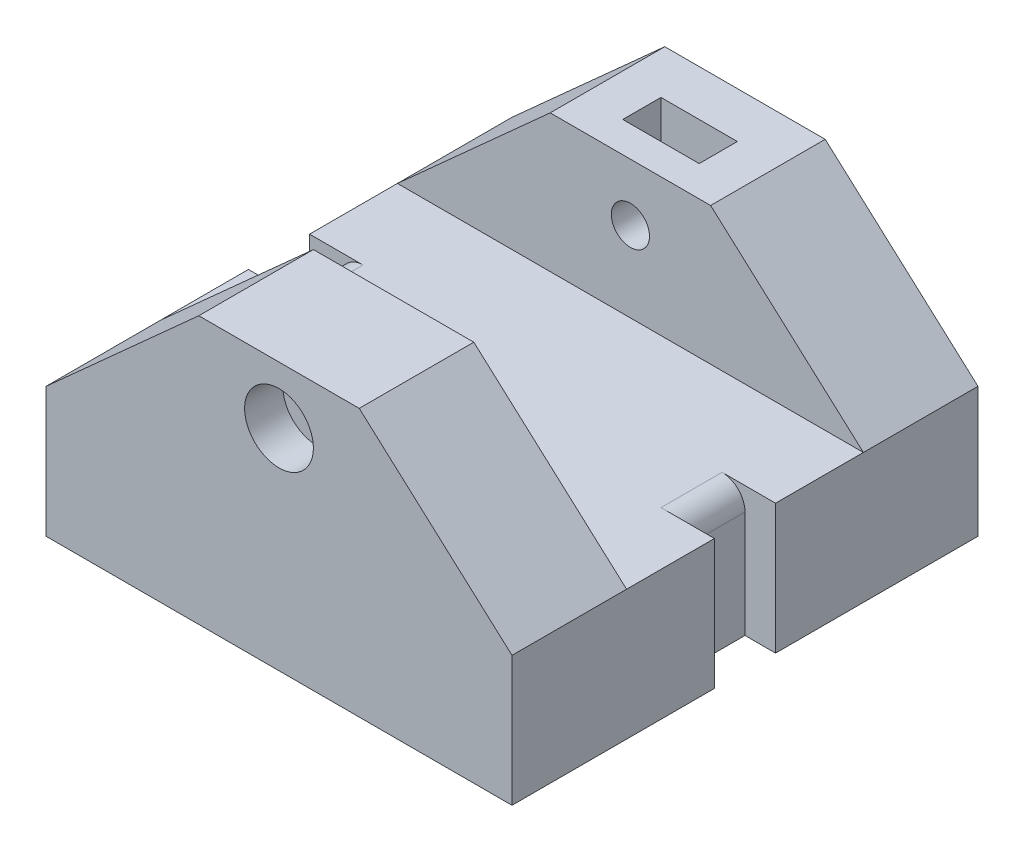
from build123d import *

# Parameters (mm, degrees)
SKETCH1_W           = 61
SKETCH1_H           = 61
SKETCH1_W_2         = 41
SKETCH1_H_2         = 41
BOSS_EXTRUDE1_DEPTH = 15
SKETCH2_W           = 61
SKETCH2_H           = 61
BOSS_EXTRUDE2_DEPTH = 20
SKETCH3_R           = 2.5
CUT_EXTRUDE1_DEPTH  = 90
SKETCH5_W           = 31
SKETCH5_H           = 18
CUT_EXTRUDE2_DEPTH  = 90
SKETCH6_W           = 4
SKETCH6_H           = 8
CUT_EXTRUDE3_DEPTH  = 90
SKETCH7_R           = 4.5
CUT_EXTRUDE4_DEPTH  = 5
SKETCH8_W           = 10
SKETCH8_H           = 5
CUT_EXTRUDE5_DEPTH  = 13
FILLET1_R           = 3


with BuildPart() as part:
    # Sketch1 → Boss-Extrude1 (new body)
    with BuildSketch(Plane(origin=(0, 0, 0), x_dir=(1, 0, 0), z_dir=(0, 1, 0))):
        with Locations((-20.5, 0)):
            Rectangle(SKETCH1_W, SKETCH1_H)
        with Locations((-20.5, 0)):
            Rectangle(SKETCH1_W_2, SKETCH1_H_2, mode=Mode.SUBTRACT)
    extrude(amount=BOSS_EXTRUDE1_DEPTH)

    # Sketch2 → Boss-Extrude2 (add)
    with BuildSketch(Plane(origin=(0, 15, 0), x_dir=(1, 0, 0), z_dir=(0, 1, 0))):
        with Locations((-20.5, 0)):
            Rectangle(SKETCH2_W, SKETCH2_H)
    extrude(amount=BOSS_EXTRUDE2_DEPTH)

    # Sketch3 → Cut-Extrude1 (cut)
    with BuildSketch(Plane.XY.offset(30.5)):
        with Locations((-20.5, 27.5)):
            Circle(SKETCH3_R)
        Polygon((-51, 17), (-31, 35), (-51, 35), align=None)
        Polygon((-10, 35), (10, 17), (10, 35), align=None)
    extrude(amount=-CUT_EXTRUDE1_DEPTH, mode=Mode.SUBTRACT)

    # Sketch5 → Cut-Extrude2 (cut)
    with BuildSketch(Plane(origin=(10, 0, 0), x_dir=(0, 0, -1), z_dir=(1, 0, 0))):
        with Locations((0, 26)):
            Rectangle(SKETCH5_W, SKETCH5_H)
    extrude(amount=-CUT_EXTRUDE2_DEPTH, mode=Mode.SUBTRACT)

    # Sketch6 → Cut-Extrude3 (cut)
    with BuildSketch(Plane(origin=(0, 17, 0), x_dir=(1, 0, 0), z_dir=(0, 1, 0))):
        with Locations((-49, 0)):
            Rectangle(SKETCH6_W, SKETCH6_H)
        with Locations((8, 0)):
            Rectangle(SKETCH6_W, SKETCH6_H)
    extrude(amount=-CUT_EXTRUDE3_DEPTH, mode=Mode.SUBTRACT)

    # Sketch7 → Cut-Extrude4 (cut)
    with BuildSketch(Plane.XY.offset(30.5)):
        with Locations((-20.5, 27.5)):
            Circle(SKETCH7_R)
    extrude(amount=-CUT_EXTRUDE4_DEPTH, mode=Mode.SUBTRACT)

    # Sketch8 → Cut-Extrude5 (cut)
    with BuildSketch(Plane(origin=(0, 35, 0), x_dir=(1, 0, 0), z_dir=(0, 1, 0))):
        with Locations((-20.5, 22)):
            Rectangle(SKETCH8_W, SKETCH8_H)
    extrude(amount=-CUT_EXTRUDE5_DEPTH, mode=Mode.SUBTRACT)

    # Fillet1
    fillet1_edges = [part.edges().sort_by_distance(p)[0] for p in [
        (6, 17, 0),
        (-47, 17, 0),
    ]]
    fillet(fillet1_edges, radius=FILLET1_R)


solid = part.part
